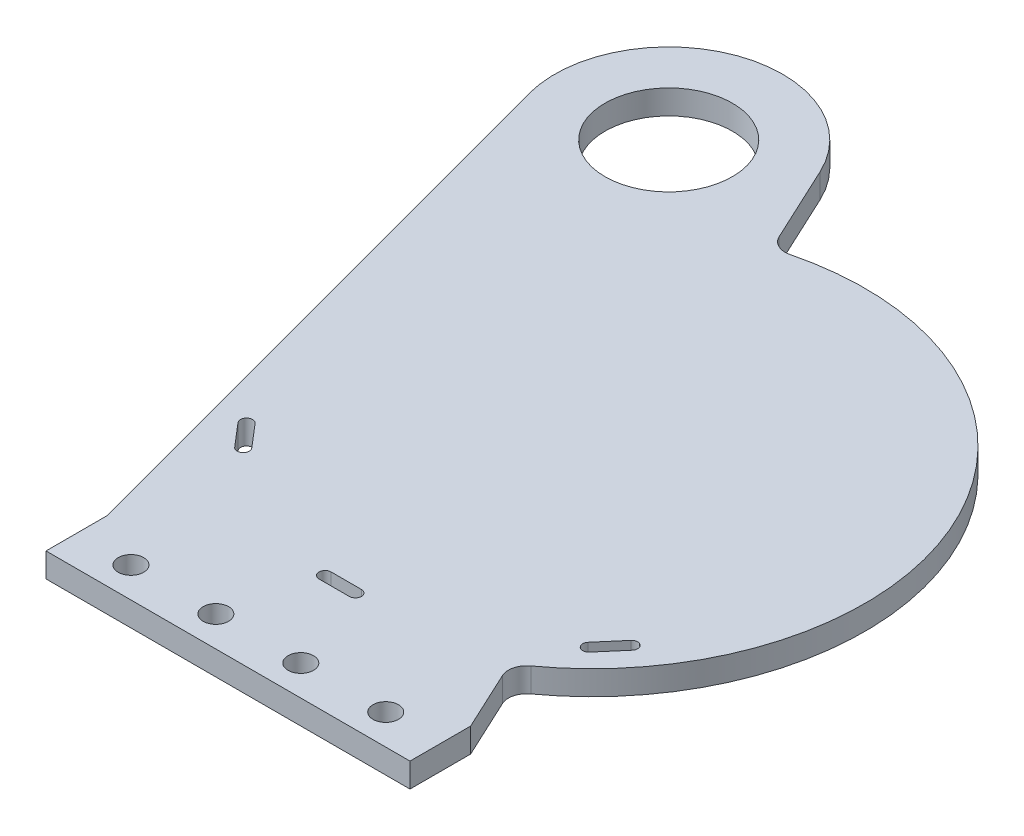
from build123d import *

# Parameters (mm, degrees)
SKETCH_1_R             = 10.5
EXTRUDE_1_DEPTH        = 4
SKETCH_4_R             = 2.1
CUT_EXTRUDE_1346_DEPTH = 150.081575092


with BuildPart() as part:
    # 草图1 → 凸台-拉伸1 (new body)
    with BuildSketch(Plane(origin=(0, 0, 0), x_dir=(1, 0, 0), z_dir=(0, 1, 0))):
        with BuildLine():
            Line((0, 0), (60, 0))
            Line((60, 0), (60, 10))
            Line((60, 10), (55.411884484, 19.839245477))
            ThreePointArc((55.411884484, 19.839245477), (55.227167567, 21.861337052), (56.372632354, 23.537906496))
            ThreePointArc((56.372632354, 23.537906496), (70.783850417, 79.017821778), (19.020417199, 103.639990393))
            ThreePointArc((19.020417199, 103.639990393), (16.99979992, 103.840191523), (15.569521651, 105.281468301))
            Line((15.569521651, 105.281468301), (9.668235965, 117.936816295))
            ThreePointArc((9.668235965, 117.936816295), (-13.775496492, 127.647528231), (-25.492512153, 105.139350566))
            Line((-25.492512153, 105.139350566), (0, 10))
            Line((0, 10), (0, 0))
        make_face()
        with Locations(Location((-7.352321507, 110, 0), (0, 0, 270))):
            Circle(SKETCH_1_R, mode=Mode.SUBTRACT)
        with BuildLine():
            Line((26.5, 20.5), (31.5, 20.5))
            ThreePointArc((31.5, 20.5), (32.5, 19.5), (31.5, 18.5))
            Line((31.5, 18.5), (26.5, 18.5))
            ThreePointArc((26.5, 18.5), (25.5, 19.5), (26.5, 20.5))
        make_face(mode=Mode.SUBTRACT)
        with BuildLine():
            Line((-0.975772037, 35.443910191), (2.27680142, 31.646441837))
            ThreePointArc((2.27680142, 31.646441837), (2.167822441, 30.236433474), (0.757814079, 30.345412454))
            Line((0.757814079, 30.345412454), (-2.494759379, 34.142880808))
            ThreePointArc((-2.494759379, 34.142880808), (-2.3857804, 35.552889171), (-0.975772037, 35.443910191))
        make_face(mode=Mode.SUBTRACT)
        with BuildLine():
            Line((60.975772037, 35.443910191), (57.72319858, 31.646441837))
            ThreePointArc((57.72319858, 31.646441837), (57.832177559, 30.236433474), (59.242185921, 30.345412454))
            Line((59.242185921, 30.345412454), (62.494759379, 34.142880808))
            ThreePointArc((62.494759379, 34.142880808), (62.3857804, 35.552889171), (60.975772037, 35.443910191))
        make_face(mode=Mode.SUBTRACT)
    extrude(amount=EXTRUDE_1_DEPTH)

    # 草图4 → Cut-Extrude 1346 (cut, through all)
    with BuildSketch(Plane.XZ):
        with Locations(Location((37, -5, 0), (0, 0, 270))):
            Circle(SKETCH_4_R)
        with Locations(Location((51, -5, 0), (0, 0, 270))):
            Circle(SKETCH_4_R)
        with Locations(Location((9, -5, 0), (0, 0, 90))):
            Circle(SKETCH_4_R)
        with Locations(Location((23, -5, 0), (0, 0, 90))):
            Circle(SKETCH_4_R)
    extrude(amount=-CUT_EXTRUDE_1346_DEPTH, mode=Mode.SUBTRACT)


solid = part.part
